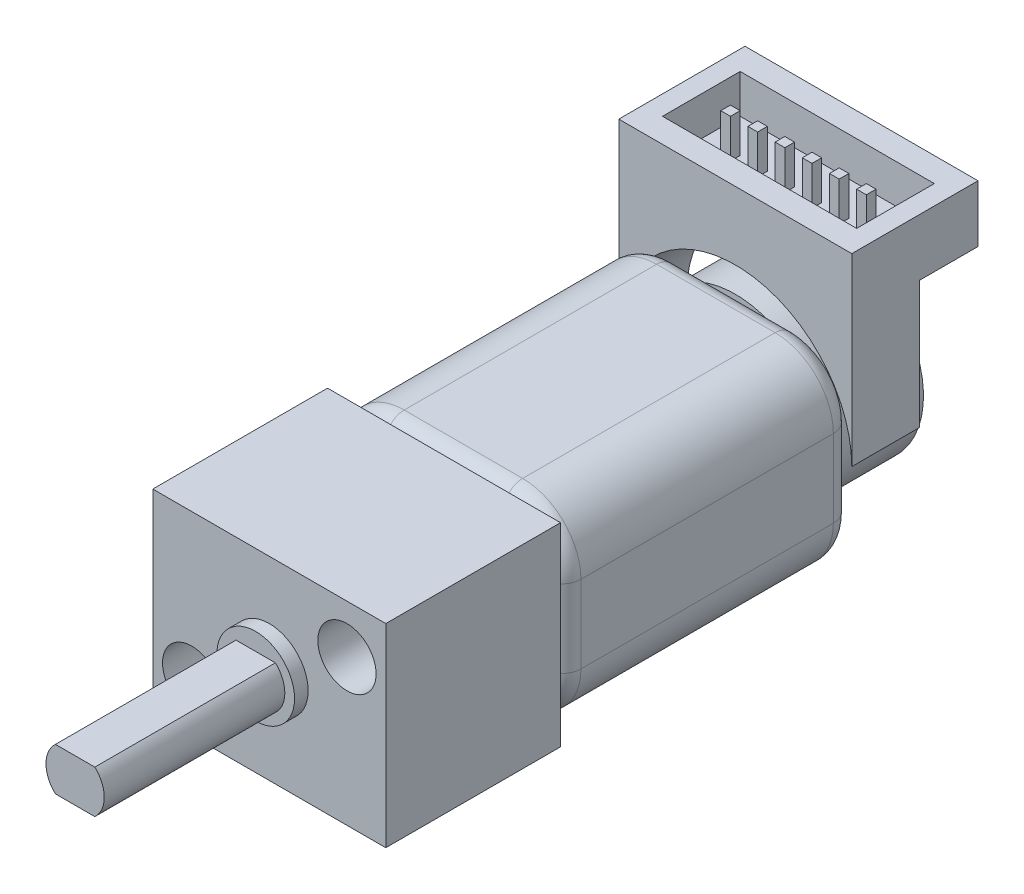
from build123d import *

# Parameters (mm, degrees)
SKETCH_3_W                 = 12.1
SKETCH_3_H                 = 10
EXTRUDE_2_DEPTH            = 15
FILLET_3_R                 = 3
FILLET_4_R                 = 1
SKETCH_4_W                 = 12
SKETCH_4_H                 = 10
EXTRUDE_3_DEPTH            = 9
SKETCH_5_R                 = 2
EXTRUDE_4_DEPTH            = 0.7
SKETCH_6_R                 = 1.5
EXTRUDE_5_DEPTH            = 9.3
HOLE_WIZARD_3_0_3_1_D      = 3
HOLE_WIZARD_3_0_3_1_DEPTH  = 2.5
HOLE_WIZARD_3_0_3_1_TIP    = 0.901290929
EXTRUDE_7_DEPTH            = 6.5
SKETCH_11_R                = 4.692908565
EXTRUDE_8_DEPTH            = 5
CUT_EXTRUDE_1_DEPTH        = 3
SKETCH_13_W                = 10
SKETCH_13_H                = 4
CUT_EXTRUDE_2_DEPTH        = 2
SKETCH_14_W                = 0.5
SKETCH_14_H                = 0.5
EXTRUDE_9_DEPTH            = 2
PATTERN_LINEAR_1_COUNT     = 3
PATTERN_LINEAR_1_PITCH     = 1.4
PATTERN_LINEAR_1_COL_COUNT = 4
PATTERN_LINEAR_1_COL_PITCH = 1.4
CUT_EXTRUDE_START          = -9.3
CUT_EXTRUDE_3_DEPTH        = 9.3


with BuildPart() as part:
    # 草图3 → 凸台-拉伸2 (new body)
    with BuildSketch(Plane.XY):
        Rectangle(SKETCH_3_W, SKETCH_3_H)
    extrude(amount=EXTRUDE_2_DEPTH)

    # 圆角3
    fillet_3_edges = [part.edges().sort_by_distance(p)[0] for p in [
        (6.05, -5, 7.5),
        (-6.05, -5, 7.5),
        (-6.05, 5, 7.5),
        (6.05, 5, 7.5),
    ]]
    fillet(fillet_3_edges, radius=FILLET_3_R)

    # 圆角4
    fillet_4_edges = [part.edges().sort_by_distance(p)[0] for p in [
        (0, -5, 0),
        (0, -5, 15),
        (6.05, 0, 0),
        (-6.05, 0, 0),
        (0, 5, 0),
        (5.171320344, 4.121320344, 0),
        (5.171320344, -4.121320344, 0),
        (-5.171320344, 4.121320344, 0),
        (-5.171320344, -4.121320344, 0),
        (-6.05, 0, 15),
        (6.05, 0, 15),
        (0, 5, 15),
        (5.171320344, 4.121320344, 15),
        (5.171320344, -4.121320344, 15),
        (-5.171320344, 4.121320344, 15),
        (-5.171320344, -4.121320344, 15),
    ]]
    fillet(fillet_4_edges, radius=FILLET_4_R)

    # 草图4 → 凸台-拉伸3 (add)
    with BuildSketch(Plane.XY.offset(15)):
        Rectangle(SKETCH_4_W, SKETCH_4_H)
    extrude(amount=EXTRUDE_3_DEPTH)

    # 草图5 → 凸台-拉伸4 (add)
    with BuildSketch(Plane.XY.offset(24)):
        Circle(SKETCH_5_R)
    extrude(amount=EXTRUDE_4_DEPTH)

    # 草图6 → 凸台-拉伸5 (add)
    with BuildSketch(Plane.XY.offset(24.7)):
        Circle(SKETCH_6_R)
    extrude(amount=EXTRUDE_5_DEPTH)

    # Ø3.0 (3) 直径孔1
    with Locations(Plane.XY.offset(24)):
        with Locations((-4, -2.5), (4, 2.5)):
            Hole(HOLE_WIZARD_3_0_3_1_D / 2, depth=HOLE_WIZARD_3_0_3_1_DEPTH)
            with Locations((0, 0, -(HOLE_WIZARD_3_0_3_1_DEPTH + HOLE_WIZARD_3_0_3_1_TIP / 2))):  # 118° drill point
                Cone(0, HOLE_WIZARD_3_0_3_1_D / 2, HOLE_WIZARD_3_0_3_1_TIP, mode=Mode.SUBTRACT)

    # 草图11 → 凸台-拉伸8 (add)
    with BuildSketch(Plane(origin=(0, 0, 0), x_dir=(-1, 0, 0), z_dir=(0, 0, -1))):
        with Locations(Location((0, 0, 0), (0, 0, 121.531818608))):
            Circle(SKETCH_11_R)
    extrude(amount=EXTRUDE_8_DEPTH)

    # 草图15 → 切除-拉伸3 (cut)
    with BuildSketch(Plane.XY.offset(34).offset(CUT_EXTRUDE_START)):
        with BuildLine():
            Line((-1.014446226, 1.104942919), (1.014446226, 1.104942919))
            ThreePointArc((1.014446226, 1.104942919), (0, 1.5), (-1.014446226, 1.104942919))
        make_face()
        with BuildLine():
            Line((-1.014446226, -1.104942919), (1.014446226, -1.104942919))
            ThreePointArc((1.014446226, -1.104942919), (0, -1.5), (-1.014446226, -1.104942919))
        make_face()
    extrude(amount=CUT_EXTRUDE_3_DEPTH, mode=Mode.SUBTRACT)


with BuildPart() as body_2:
    # 草图10 → 凸台-拉伸7 (new body)
    with BuildSketch(Plane(origin=(0, 0, 0), x_dir=(-1, 0, 0), z_dir=(0, 0, -1))):
        with BuildLine():
            Line((-6, 0), (-6, 9.5))
            Line((-6, 9.5), (6, 9.5))
            Line((6, 9.5), (6, 0))
            ThreePointArc((6, 0), (0, 6), (-6, 0))
        make_face()
    extrude(amount=EXTRUDE_7_DEPTH)

    # 草图12 → 切除-拉伸1 (cut)
    with BuildSketch(Plane(origin=(0, 0, -6.5), x_dir=(-1, 0, 0), z_dir=(0, 0, -1))):
        with BuildLine():
            Line((-6, 0), (-6, 6.565194245))
            Line((-6, 6.565194245), (6, 6.565194245))
            Line((6, 6.565194245), (6, 0))
            ThreePointArc((6, 0), (0, 6), (-6, 0))
        make_face()
    extrude(amount=-CUT_EXTRUDE_1_DEPTH, mode=Mode.SUBTRACT)

    # 草图13 → 切除-拉伸2 (cut)
    with BuildSketch(Plane(origin=(0, 9.5, 0), x_dir=(1, 0, 0), z_dir=(0, 1, 0))):
        with Locations((0, 3.25)):
            Rectangle(SKETCH_13_W, SKETCH_13_H)
    extrude(amount=-CUT_EXTRUDE_2_DEPTH, mode=Mode.SUBTRACT)

    # 草图14 → 凸台-拉伸9 (add)
    with BuildSketch(Plane(origin=(0, 7.5, 0), x_dir=(1, 0, 0), z_dir=(0, 1, 0))):
        with Locations((-0.7, 3.25)):
            Rectangle(SKETCH_14_W, SKETCH_14_H)
    extrude_9 = extrude(amount=EXTRUDE_9_DEPTH)

    # 阵列(线性)1: 凸台-拉伸9 ×3
    with Locations(*[(-i * PATTERN_LINEAR_1_PITCH, 0, 0) for i in range(1, PATTERN_LINEAR_1_COUNT)]):
        add(extrude_9)

    # 阵列(线性)1 col: 凸台-拉伸9 ×4
    with Locations(*[(i * PATTERN_LINEAR_1_COL_PITCH, 0, 0) for i in range(1, PATTERN_LINEAR_1_COL_COUNT)]):
        add(extrude_9)


solid = Compound([part.part, body_2.part])
